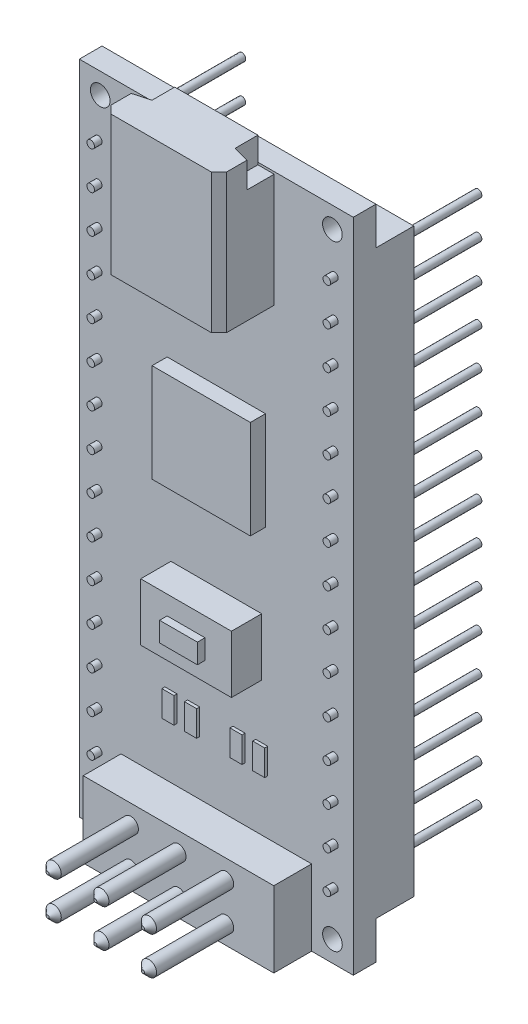
from build123d import *

# Parameters (mm, degrees)
ESQUISSE1_W             = 18.11
ESQUISSE1_H             = 43.4
BOSS_EXTRU_1_DEPTH      = 1.5
ESQUISSE2_W             = 7.65
ESQUISSE2_H             = 7.65
ESQUISSE2_H_2           = 1.55
BOSS_EXTRU_2_DEPTH      = 3.65
ESQUISSE3_W             = 12.6
ESQUISSE3_H             = 5
BOSS_EXTRU_3_DEPTH      = 2.5
ESQUISSE4_W             = 2.5
ESQUISSE4_H             = 38.4
BOSS_EXTRU_4_DEPTH      = 2.5
BOSS_EXTRU_5_DEPTH      = 5.5
BOSS_EXTRU_5_DEPTH_BACK = 4.5
ESQUISSE5_R             = 0.25
ESQUISSE6_W             = 6.5
ESQUISSE6_H             = 6.5
BOSS_EXTRU_6_DEPTH      = 1
ESQUISSE7_W             = 6
ESQUISSE7_H             = 3.8
BOSS_EXTRU_9_DEPTH      = 2
ESQUISSE8_W             = 2.5
ESQUISSE8_H             = 1.3
BOSS_EXTRU_10_DEPTH     = 0.5
ESQUISSE9_W             = 0.8
ESQUISSE9_H             = 1.7
BOSS_EXTRU_11_DEPTH     = 0.2
ESQUISSE10_R            = 0.5
BOSS_EXTRU_12_DEPTH     = 5.5
CHANFREIN1_SIZE         = 0.4
ENL_V_MAT_EXTRU_1_DEPTH = 1.7
CHANFREIN2_SIZE         = 0.5
ESQUISSE12_R            = 0.65
ENL_V_MAT_EXTRU_2_DEPTH = 5.7
ESQUISSE13_W            = 5.5
ESQUISSE13_H            = 3
ESQUISSE13_W_2          = 3.5
ESQUISSE13_H_2          = 10
ESQUISSE13_W_3          = 1
ESQUISSE13_H_3          = 2
BOSS_EXTRU_13_DEPTH     = 1


with BuildPart() as part:
    # Esquisse1 → Boss.-Extru.1 (new body)
    with BuildSketch(Plane.XY):
        with Locations((-9.055, 21.7)):
            Rectangle(ESQUISSE1_W, ESQUISSE1_H)
    extrude(amount=BOSS_EXTRU_1_DEPTH)

    # Esquisse2 → Boss.-Extru.2 (add)
    with BuildSketch(Plane.XY.offset(1.5)):
        with Locations((-9.055, 39.575)):
            Rectangle(ESQUISSE2_W, ESQUISSE2_H)
        with Locations((-9.055, 44.175)):
            Rectangle(ESQUISSE2_W, ESQUISSE2_H_2)
    extrude(amount=BOSS_EXTRU_2_DEPTH)

    # Esquisse3 → Boss.-Extru.3 (add)
    with BuildSketch(Plane.XY.offset(1.5)):
        with Locations((-9.055, 2.5)):
            Rectangle(ESQUISSE3_W, ESQUISSE3_H)
    extrude(amount=BOSS_EXTRU_3_DEPTH)

    # Esquisse4 → Boss.-Extru.4 (add)
    with BuildSketch(Plane(origin=(0, 0, 0), x_dir=(-1, 0, 0), z_dir=(0, 0, -1))):
        with Locations((1.25, 21.7)):
            Rectangle(ESQUISSE4_W, ESQUISSE4_H)
        with Locations((16.86, 21.7)):
            Rectangle(ESQUISSE4_W, ESQUISSE4_H)
    extrude(amount=BOSS_EXTRU_4_DEPTH)

    # Esquisse5 → Boss.-Extru.5 (add, two sides: drawn at the far end of the back side and taken through both)
    with BuildSketch(Plane(origin=(0, 0, -2.5), x_dir=(-1, 0, 0), z_dir=(0, 0, -1)).offset(-BOSS_EXTRU_5_DEPTH_BACK)):
        with Locations((16.86, 39.4)):
            Circle(ESQUISSE5_R)
        with Locations((16.86, 36.9)):
            Circle(ESQUISSE5_R)
        with Locations((16.86, 34.4)):
            Circle(ESQUISSE5_R)
        with Locations((16.86, 31.9)):
            Circle(ESQUISSE5_R)
        with Locations((16.86, 29.4)):
            Circle(ESQUISSE5_R)
        with Locations((16.86, 26.9)):
            Circle(ESQUISSE5_R)
        with Locations((16.86, 24.4)):
            Circle(ESQUISSE5_R)
        with Locations((16.86, 21.9)):
            Circle(ESQUISSE5_R)
        with Locations((16.86, 19.4)):
            Circle(ESQUISSE5_R)
        with Locations((16.86, 16.9)):
            Circle(ESQUISSE5_R)
        with Locations((16.86, 14.4)):
            Circle(ESQUISSE5_R)
        with Locations((16.86, 11.9)):
            Circle(ESQUISSE5_R)
        with Locations((16.86, 9.4)):
            Circle(ESQUISSE5_R)
        with Locations((16.86, 6.9)):
            Circle(ESQUISSE5_R)
        with Locations((16.86, 4.4)):
            Circle(ESQUISSE5_R)
        with Locations((1.25, 4.4)):
            Circle(ESQUISSE5_R)
        with Locations((1.25, 6.9)):
            Circle(ESQUISSE5_R)
        with Locations((1.25, 9.4)):
            Circle(ESQUISSE5_R)
        with Locations((1.25, 11.9)):
            Circle(ESQUISSE5_R)
        with Locations((1.25, 14.4)):
            Circle(ESQUISSE5_R)
        with Locations((1.25, 16.9)):
            Circle(ESQUISSE5_R)
        with Locations((1.25, 19.4)):
            Circle(ESQUISSE5_R)
        with Locations((1.25, 21.9)):
            Circle(ESQUISSE5_R)
        with Locations((1.25, 24.4)):
            Circle(ESQUISSE5_R)
        with Locations((1.25, 26.9)):
            Circle(ESQUISSE5_R)
        with Locations((1.25, 29.4)):
            Circle(ESQUISSE5_R)
        with Locations((1.25, 31.9)):
            Circle(ESQUISSE5_R)
        with Locations((1.25, 34.4)):
            Circle(ESQUISSE5_R)
        with Locations((1.25, 36.9)):
            Circle(ESQUISSE5_R)
        with Locations((1.25, 39.4)):
            Circle(ESQUISSE5_R)
    extrude(amount=BOSS_EXTRU_5_DEPTH + BOSS_EXTRU_5_DEPTH_BACK)

    # Esquisse6 → Boss.-Extru.6 (add)
    with BuildSketch(Plane.XY.offset(1.5)):
        with Locations((-9.055, 26)):
            Rectangle(ESQUISSE6_W, ESQUISSE6_H)
    extrude(amount=BOSS_EXTRU_6_DEPTH)

    # Esquisse7 → Boss.-Extru.9 (add)
    with BuildSketch(Plane.XY.offset(1.5)):
        with Locations((-9.055, 15.773004759)):
            Rectangle(ESQUISSE7_W, ESQUISSE7_H)
    extrude(amount=BOSS_EXTRU_9_DEPTH)

    # Esquisse8 → Boss.-Extru.10 (add)
    with BuildSketch(Plane.XY.offset(3.5)):
        with Locations((-9.055, 15.773004759)):
            Rectangle(ESQUISSE8_W, ESQUISSE8_H)
    extrude(amount=BOSS_EXTRU_10_DEPTH)

    # Esquisse9 → Boss.-Extru.11 (add)
    with BuildSketch(Plane.XY.offset(1.5)):
        with Locations((-6.055, 9.43650238)):
            Rectangle(ESQUISSE9_W, ESQUISSE9_H)
        with Locations((-10.555, 9.43650238)):
            Rectangle(ESQUISSE9_W, ESQUISSE9_H)
        with Locations((-7.555, 9.43650238)):
            Rectangle(ESQUISSE9_W, ESQUISSE9_H)
        with Locations((-12.055, 9.43650238)):
            Rectangle(ESQUISSE9_W, ESQUISSE9_H)
    extrude(amount=BOSS_EXTRU_11_DEPTH)

    # Esquisse10 → Boss.-Extru.12 (add)
    with BuildSketch(Plane.XY.offset(4)):
        with Locations((-5.905, 1.25)):
            Circle(ESQUISSE10_R)
        with Locations((-5.905, 3.75)):
            Circle(ESQUISSE10_R)
        with Locations((-9.055, 3.75)):
            Circle(ESQUISSE10_R)
        with Locations((-12.205, 3.75)):
            Circle(ESQUISSE10_R)
        with Locations((-12.205, 1.25)):
            Circle(ESQUISSE10_R)
        with Locations((-9.055, 1.25)):
            Circle(ESQUISSE10_R)
    extrude(amount=BOSS_EXTRU_12_DEPTH)

    # Chanfrein1
    chanfrein1_edges = [part.edges().sort_by_distance(p)[0] for p in [
        (-6.405, 1.25, 9.5),
        (-6.405, 3.75, 9.5),
        (-9.555, 3.75, 9.5),
        (-12.705, 3.75, 9.5),
        (-12.705, 1.25, 9.5),
        (-9.555, 1.25, 9.5),
    ]]
    chamfer(chanfrein1_edges, length=CHANFREIN1_SIZE)

    # Esquisse11 → Enlèv. mat.-Extru.1 (cut)
    with BuildSketch(Plane(origin=(0, 44.95, 0), x_dir=(1, 0, 0), z_dir=(0, 1, 0))):
        Polygon((-6.305, -1.5), (-6.305, -3), (-5.23, -3.3), (-5.23, -1.5), align=None)
        Polygon((-11.805, -1.5), (-11.805, -3), (-12.88, -3.3), (-12.88, -1.5), align=None)
    extrude(amount=-ENL_V_MAT_EXTRU_1_DEPTH, mode=Mode.SUBTRACT)

    # Chanfrein2
    chanfrein2_edges = [part.edges().sort_by_distance(p)[0] for p in [
        (-5.23, 40.35, 5.15),
        (-12.88, 40.35, 5.15),
    ]]
    chamfer(chanfrein2_edges, length=CHANFREIN2_SIZE)

    # Esquisse12 → Enlèv. mat.-Extru.2 (cut)
    with BuildSketch(Plane.XY.offset(1.5)):
        with Locations((-16.7325, 1.38)):
            Circle(ESQUISSE12_R)
        with Locations((-1.3775, 1.38)):
            Circle(ESQUISSE12_R)
        with Locations((-16.73, 42.02)):
            Circle(ESQUISSE12_R)
        with Locations((-1.38, 42.02)):
            Circle(ESQUISSE12_R)
    extrude(amount=-ENL_V_MAT_EXTRU_2_DEPTH, mode=Mode.SUBTRACT)

    # Esquisse13 → Boss.-Extru.13 (add)
    with BuildSketch(Plane(origin=(0, 0, 0), x_dir=(-1, 0, 0), z_dir=(0, 0, -1))):
        with Locations((12.36, 8)):
            Rectangle(ESQUISSE13_W, ESQUISSE13_H)
        with Locations((7.25, 30.4)):
            Rectangle(ESQUISSE13_W_2, ESQUISSE13_H_2)
        with Locations((5.61, 40.9)):
            Rectangle(ESQUISSE13_W_3, ESQUISSE13_H)
        with Locations((7.61, 40.9)):
            Rectangle(ESQUISSE13_W_3, ESQUISSE13_H)
        with Locations((8.11, 8)):
            Rectangle(ESQUISSE13_W_3, ESQUISSE13_H)
        with Locations((11.61, 41.4)):
            Rectangle(ESQUISSE13_W_3, ESQUISSE13_H_3)
        with Locations((14.61, 41.4)):
            Rectangle(ESQUISSE13_W_3, ESQUISSE13_H_3)
        with Locations((3.61, 40.9)):
            Rectangle(ESQUISSE13_W_3, ESQUISSE13_H)
    extrude(amount=BOSS_EXTRU_13_DEPTH)


solid = part.part
